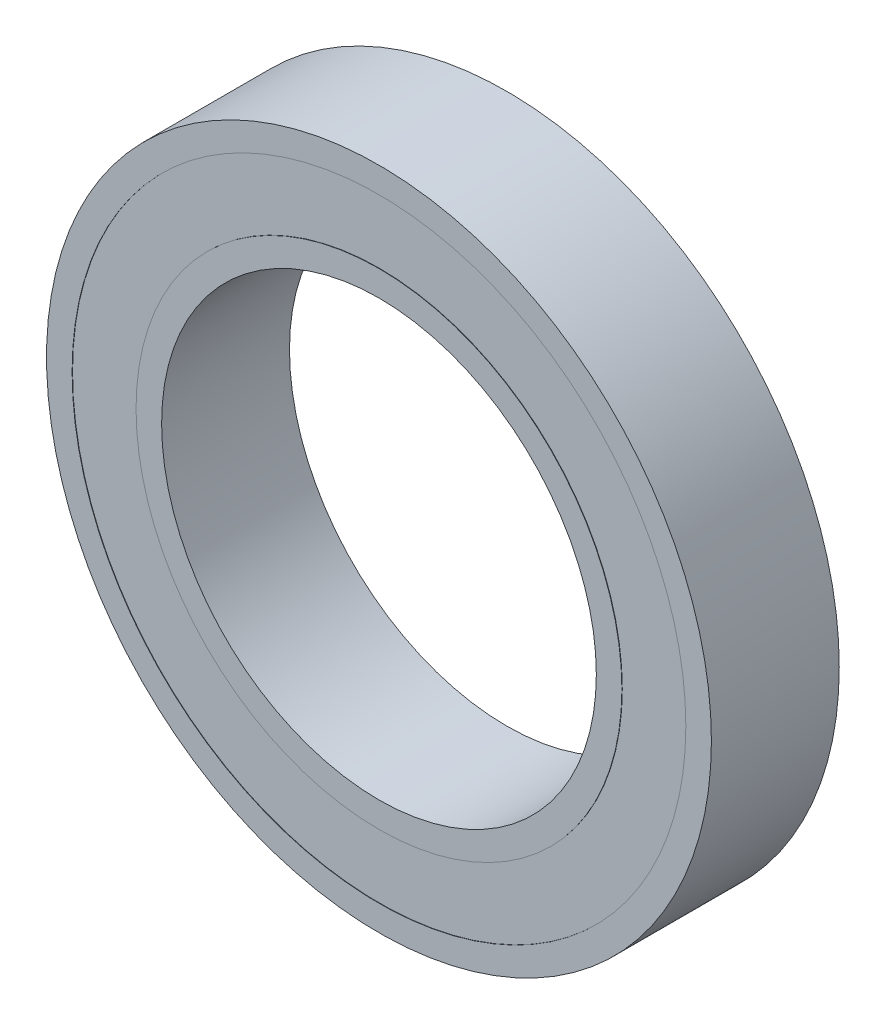
from build123d import *

# Parameters (mm, degrees)
BOSS_EXTRUDE1_DEPTH        = 2.5
BOSS_EXTRUDE1_DEPTH_BACK   = 2.5
SKETCH1_R                  = 9.5
SKETCH1_R_2                = 8.5
BOSS_EXTRUDE1_2_DEPTH      = 2.5
BOSS_EXTRUDE1_2_DEPTH_BACK = 2.5
SKETCH1_R_3                = 13
SKETCH1_R_4                = 12
BOSS_EXTRUDE2_DEPTH        = 2.484375
BOSS_EXTRUDE2_DEPTH_BACK   = 2.484375
SKETCH1_3_R                = 12
SKETCH1_3_R_2              = 9.5


with BuildPart() as part:
    # Sketch1 → Boss-Extrude1 (new, two sides: drawn at the far end of the back side and taken through both)
    with BuildSketch(Plane.XY.offset(-BOSS_EXTRUDE1_DEPTH_BACK)):
        Circle(SKETCH1_R)
        Circle(SKETCH1_R_2, mode=Mode.SUBTRACT)
    extrude(amount=BOSS_EXTRUDE1_DEPTH + BOSS_EXTRUDE1_DEPTH_BACK)



with BuildPart() as body_2:
    # Sketch1 → Boss-Extrude1 2 (new, two sides: drawn at the far end of the back side and taken through both)
    with BuildSketch(Plane.XY.offset(-BOSS_EXTRUDE1_2_DEPTH_BACK)):
        Circle(SKETCH1_R_3)
        Circle(SKETCH1_R_4, mode=Mode.SUBTRACT)
    extrude(amount=BOSS_EXTRUDE1_2_DEPTH + BOSS_EXTRUDE1_2_DEPTH_BACK)


with BuildPart() as part_1:
    add(part.part)

    add(body_2.part)  # Boss-Extrude2 merges body 2
    # Sketch1<3> → Boss-Extrude2 (add, two sides: drawn at the far end of the back side and taken through both)
    with BuildSketch(Plane.XY.offset(-BOSS_EXTRUDE2_DEPTH_BACK)):
        Circle(SKETCH1_3_R)
        Circle(SKETCH1_3_R_2, mode=Mode.SUBTRACT)
    extrude(amount=BOSS_EXTRUDE2_DEPTH + BOSS_EXTRUDE2_DEPTH_BACK)


solid = part_1.part
